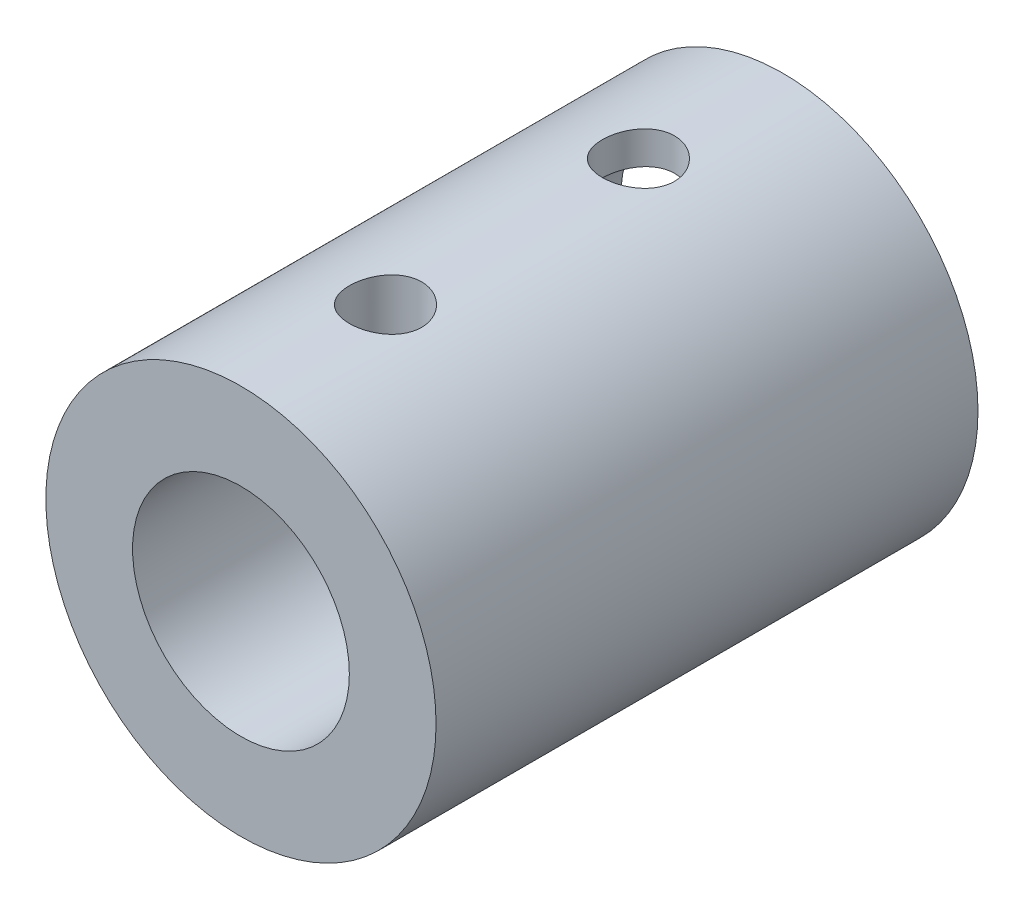
from build123d import *

# Parameters (mm, degrees)
CROQUIS2_R            = 1
CORTAR_EXTRUIR1_DEPTH = 10
CROQUIS3_R            = 3
CORTAR_EXTRUIR2_DEPTH = 7.5
CROQUIS4_R            = 4.5
CORTAR_EXTRUIR3_DEPTH = 7.5


with BuildPart() as part:
    # Croquis1 → Revolución1 (revolve)
    with BuildSketch(Plane(origin=(0, 0, 0), x_dir=(1, 0, 0), z_dir=(0, 1, 0))):
        Polygon((0, -7.5), (0, 0), (0, 7.5), (5.4, 7.5), (5.4, -7.5), align=None)
    revolve(axis=Axis((0, 0, 0), (0, 0, -1)))

    # Croquis2 → Cortar-Extruir1 (cut)
    with BuildSketch(Plane(origin=(0, 0, 0), x_dir=(1, 0, 0), z_dir=(0, 1, 0))):
        with Locations(Location((0, -3.5, 0), (0, 0, 90))):
            Circle(CROQUIS2_R)
        with Locations(Location((0, 3.5, 0), (0, 0, 90))):
            Circle(CROQUIS2_R)
    extrude(amount=CORTAR_EXTRUIR1_DEPTH, mode=Mode.SUBTRACT)

    # Croquis3 → Cortar-Extruir2 (cut)
    with BuildSketch(Plane.XY.offset(7.5)):
        Circle(CROQUIS3_R)
    extrude(amount=-CORTAR_EXTRUIR2_DEPTH, mode=Mode.SUBTRACT)

    # Croquis4 → Cortar-Extruir3 (cut)
    with BuildSketch(Plane(origin=(0, 0, -7.5), x_dir=(-1, 0, 0), z_dir=(0, 0, -1))):
        Circle(CROQUIS4_R)
    extrude(amount=-CORTAR_EXTRUIR3_DEPTH, mode=Mode.SUBTRACT)


solid = part.part
